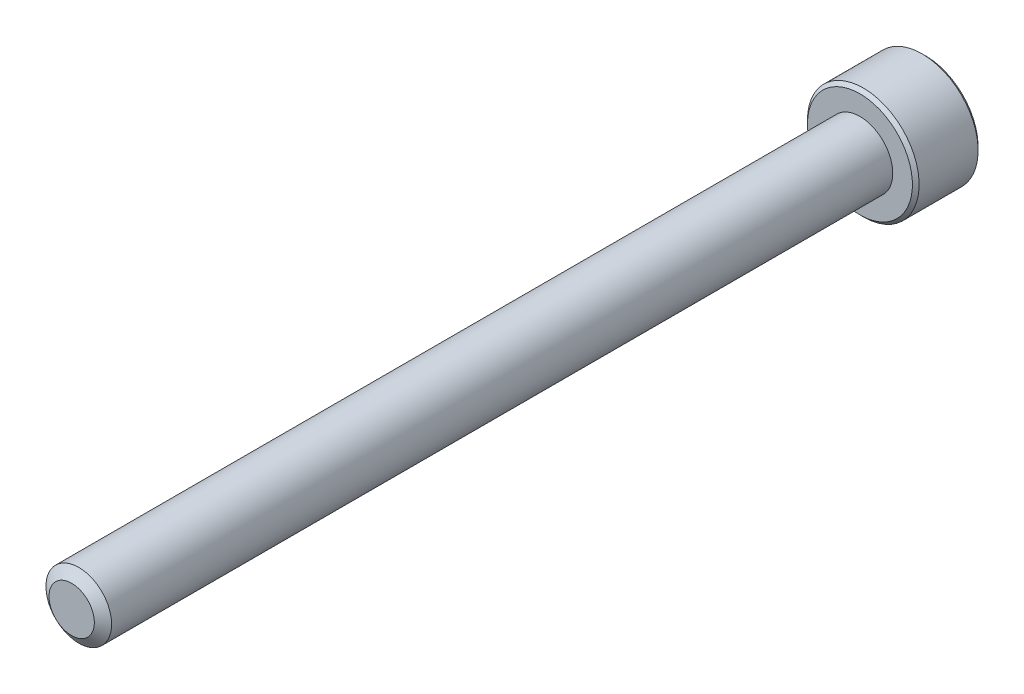
from build123d import *

# Parameters (mm, degrees)
SKETCH1_R          = 2.5
EXTRUDE1_DEPTH     = 60
SKETCH6_R          = 4.25
EXTRUDE2_DEPTH     = 5
CUT_EXTRUDE1_DEPTH = 3
CHAMFER1_SIZE      = 0.255


with BuildPart() as part:
    # Sketch1 → Extrude1 (new body)
    with BuildSketch(Plane.XY):
        Circle(SKETCH1_R)
    extrude(amount=-EXTRUDE1_DEPTH)

    # Sketch4 → Cut-Revolve1 (revolve, cut)
    with BuildSketch(Plane(origin=(0, 0, 0), x_dir=(0, 0, -1), z_dir=(1, 0, 0))):
        Polygon((0.541691224, 2.5), (0, 1.726384758), (0, 2.5), align=None)
    revolve(axis=Axis((0, 0, 0), (0, 0, -1)), mode=Mode.SUBTRACT)

    # Sketch6 → Extrude2 (add)
    with BuildSketch(Plane(origin=(0, 0, -60), x_dir=(-1, 0, 0), z_dir=(0, 0, -1))):
        Circle(SKETCH6_R)
    extrude(amount=EXTRUDE2_DEPTH)

    # Sketch7 → Cut-Extrude1 (cut)
    with BuildSketch(Plane(origin=(0, 0, -65), x_dir=(-1, 0, 0), z_dir=(0, 0, -1))):
        Polygon((0, 2.309401077), (-2, 1.154700538), (-2, -1.154700538), (0, -2.309401077), (2, -1.154700538), (2, 1.154700538), align=None)
    extrude(amount=-CUT_EXTRUDE1_DEPTH, mode=Mode.SUBTRACT)

    # Cut-Extrude2 cone 1 section (through the dimple's axis) → Cut-Extrude2 (revolve, cut)
    with BuildSketch(Plane(origin=(0, 0, -65), x_dir=(0, 1, 0), z_dir=(1, 0, 0))):
        Polygon((0, 0), (2.309401077, 0), (0, 2.309401077), align=None)
    revolve(axis=Axis((0, 0, -65), (0, 0, 1)), mode=Mode.SUBTRACT)

    # Chamfer1
    chamfer1_edges = [part.edges().sort_by_distance(p)[0] for p in [
        (4.25, 0, -65),
        (4.25, 0, -60),
    ]]
    chamfer(chamfer1_edges, length=CHAMFER1_SIZE)

    # Sketch10 → Revolve1 (revolve)
    with BuildSketch(Plane(origin=(0, 0, 0), x_dir=(0, 0, -1), z_dir=(1, 0, 0))):
        Polygon((60, 2.5), (60, 0), (58.764466094, 0), (59.8, 2.5), align=None)
    revolve(axis=Axis((0, 0, -60), (0, 0, 1)))


solid = part.part
